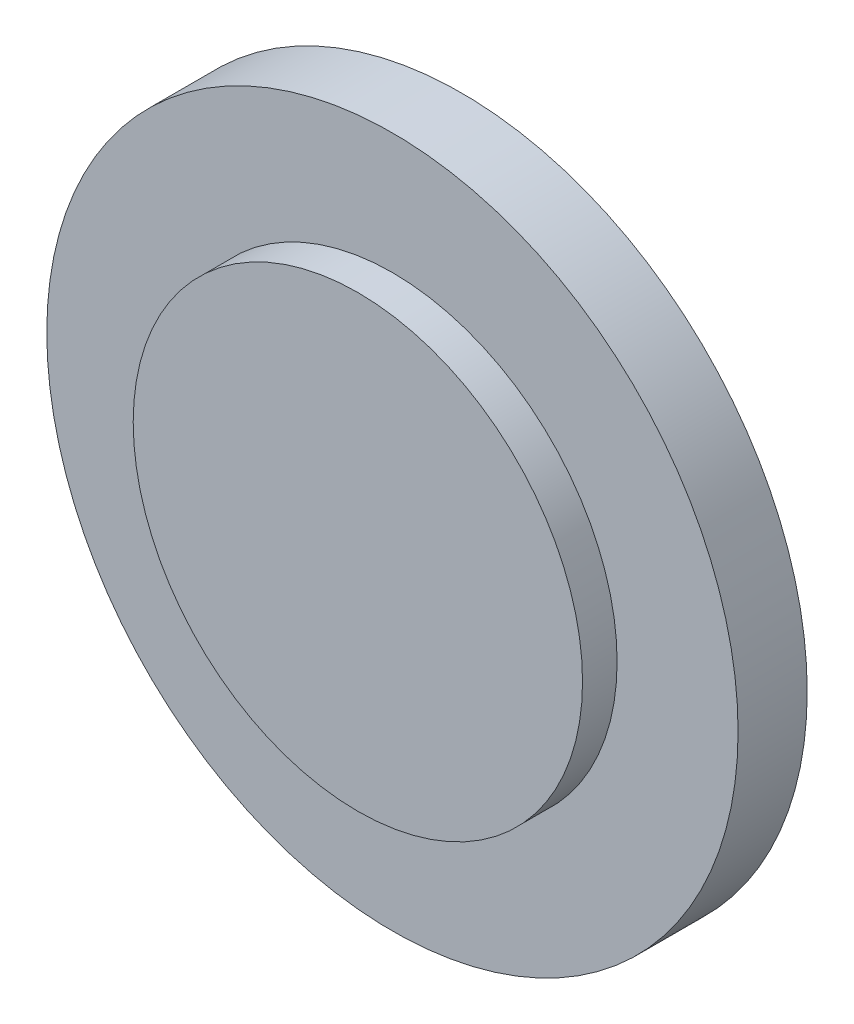
from build123d import *

# Parameters (mm, degrees)
SKETCH1_R           = 5
BOSS_EXTRUDE1_DEPTH = 1
SKETCH2_R           = 3.25
BOSS_EXTRUDE2_DEPTH = 0.5


with BuildPart() as part:
    # Sketch1 → Boss-Extrude1 (new body)
    with BuildSketch(Plane.XY):
        Circle(SKETCH1_R)
    extrude(amount=BOSS_EXTRUDE1_DEPTH)

    # Sketch2 → Boss-Extrude2 (add)
    with BuildSketch(Plane.XY.offset(1)):
        Circle(SKETCH2_R)
    extrude(amount=BOSS_EXTRUDE2_DEPTH)


solid = part.part
